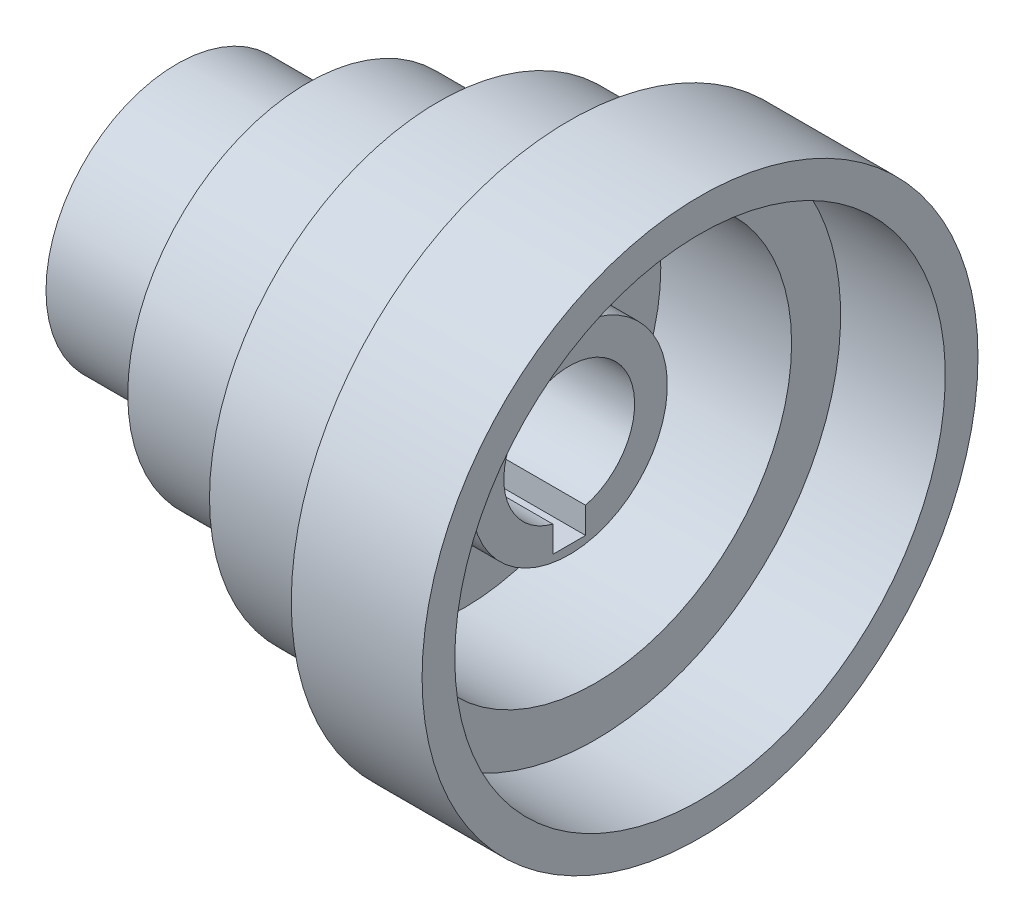
from build123d import *

# Parameters (mm, degrees)
SKETCH2_R          = 20
CUT_EXTRUDE1_DEPTH = 201.124960962


with BuildPart() as part:
    # Sketch1 → Revolve1 (revolve)
    with BuildSketch(Plane.XY, mode=Mode.PRIVATE) as revolve1_sk:
        Polygon((-80, 20), (-80, 40), (-40, 40), (-40, 55), (0, 55), (0, 70), (40, 70), (40, 85), (80, 85), (80, 75), (48, 75), (48, 60), (8, 60), (8, 45), (-32, 45), (-32, 30), (40, 30), (40, 20), align=None)
    revolve(revolve1_sk.sketch.rotate(Axis((-79.321922317, 0, 0), (1, 0, 0)), 90), axis=Axis((-79.321922317, 0, 0), (1, 0, 0)))

    # Sketch2 → Cut-Extrude1 (cut, through all)
    with BuildSketch(Plane.ZY.offset(80)):
        Circle(SKETCH2_R)
        with BuildLine():
            Line((5, -19.364916731), (5, -27.364916731))
            Line((5, -27.364916731), (-5, -27.364916731))
            Line((-5, -27.364916731), (-5, -19.364916731))
            ThreePointArc((-5, -19.364916731), (0, -20), (5, -19.364916731))
        make_face()
    extrude(amount=-CUT_EXTRUDE1_DEPTH, mode=Mode.SUBTRACT)


solid = part.part
